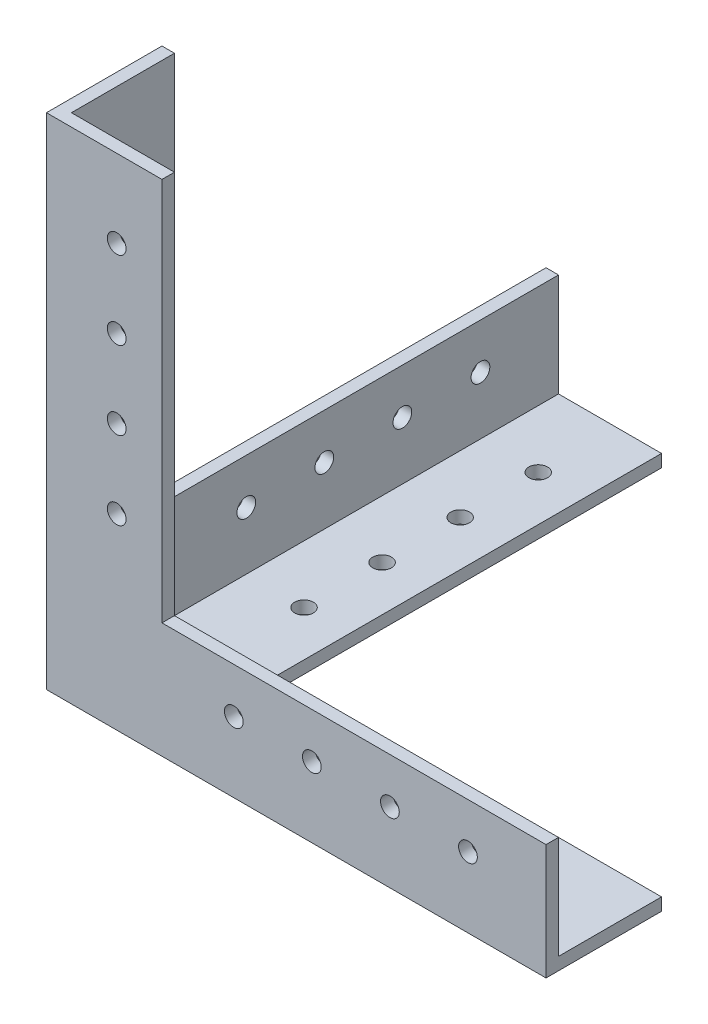
from build123d import *

# Parameters (mm, degrees)
BOSS_EXTRUDE1_DEPTH = 4
BOSS_EXTRUDE2_DEPTH = 4
BOSS_EXTRUDE3_DEPTH = 4
SKETCH5_R           = 3
CUT_EXTRUDE2_DEPTH  = 4
SKETCH6_R           = 3
CUT_EXTRUDE3_DEPTH  = 4
SKETCH7_R           = 3
CUT_EXTRUDE4_DEPTH  = 4


with BuildPart() as part:
    # Sketch1 → Boss-Extrude1 (new body)
    with BuildSketch(Plane(origin=(0, 0, 0), x_dir=(1, 0, 0), z_dir=(0, 1, 0))):
        Polygon((0, 0), (160, 0), (160, 37), (37, 37), (37, 160), (0, 160), align=None)
    extrude(amount=BOSS_EXTRUDE1_DEPTH)

    # Sketch3 → Boss-Extrude2 (add)
    with BuildSketch(Plane.XY):
        Polygon((0, 0), (0, 160), (37, 160), (37, 37), (160, 37), (160, 0), align=None)
    extrude(amount=-BOSS_EXTRUDE2_DEPTH)

    # Sketch4 → Boss-Extrude3 (add)
    with BuildSketch(Plane.ZY):
        Polygon((0, 160), (0, 0), (-160, 0), (-160, 37), (-37, 37), (-37, 160), align=None)
    extrude(amount=-BOSS_EXTRUDE3_DEPTH)

    # Sketch5 → Cut-Extrude2 (cut)
    with BuildSketch(Plane.XZ):
        with Locations((135, -22.5)):
            Circle(SKETCH5_R)
        with Locations((110, -22.5)):
            Circle(SKETCH5_R)
        with Locations((85, -22.5)):
            Circle(SKETCH5_R)
        with Locations((22.5, -135)):
            Circle(SKETCH5_R)
        with Locations((22.5, -110)):
            Circle(SKETCH5_R)
        with Locations((22.5, -85)):
            Circle(SKETCH5_R)
        with Locations((22.5, -60)):
            Circle(SKETCH5_R)
        with Locations((60, -22.5)):
            Circle(SKETCH5_R)
    extrude(amount=-CUT_EXTRUDE2_DEPTH, mode=Mode.SUBTRACT)

    # Sketch6 → Cut-Extrude3 (cut)
    with BuildSketch(Plane.ZY):
        with Locations((-135, 22.5)):
            Circle(SKETCH6_R)
        with Locations((-110, 22.5)):
            Circle(SKETCH6_R)
        with Locations((-85, 22.5)):
            Circle(SKETCH6_R)
        with Locations((-60, 22.5)):
            Circle(SKETCH6_R)
        with Locations((-22.5, 135)):
            Circle(SKETCH6_R)
        with Locations((-22.5, 110)):
            Circle(SKETCH6_R)
        with Locations((-22.5, 85)):
            Circle(SKETCH6_R)
        with Locations((-22.5, 60)):
            Circle(SKETCH6_R)
    extrude(amount=-CUT_EXTRUDE3_DEPTH, mode=Mode.SUBTRACT)

    # Sketch7 → Cut-Extrude4 (cut)
    with BuildSketch(Plane.XY):
        with Locations((22.5, 60)):
            Circle(SKETCH7_R)
        with Locations((22.5, 85)):
            Circle(SKETCH7_R)
        with Locations((22.5, 110)):
            Circle(SKETCH7_R)
        with Locations((22.5, 135)):
            Circle(SKETCH7_R)
        with Locations((60, 22.5)):
            Circle(SKETCH7_R)
        with Locations((85, 22.5)):
            Circle(SKETCH7_R)
        with Locations((110, 22.5)):
            Circle(SKETCH7_R)
        with Locations((135, 22.5)):
            Circle(SKETCH7_R)
    extrude(amount=-CUT_EXTRUDE4_DEPTH, mode=Mode.SUBTRACT)


solid = part.part
